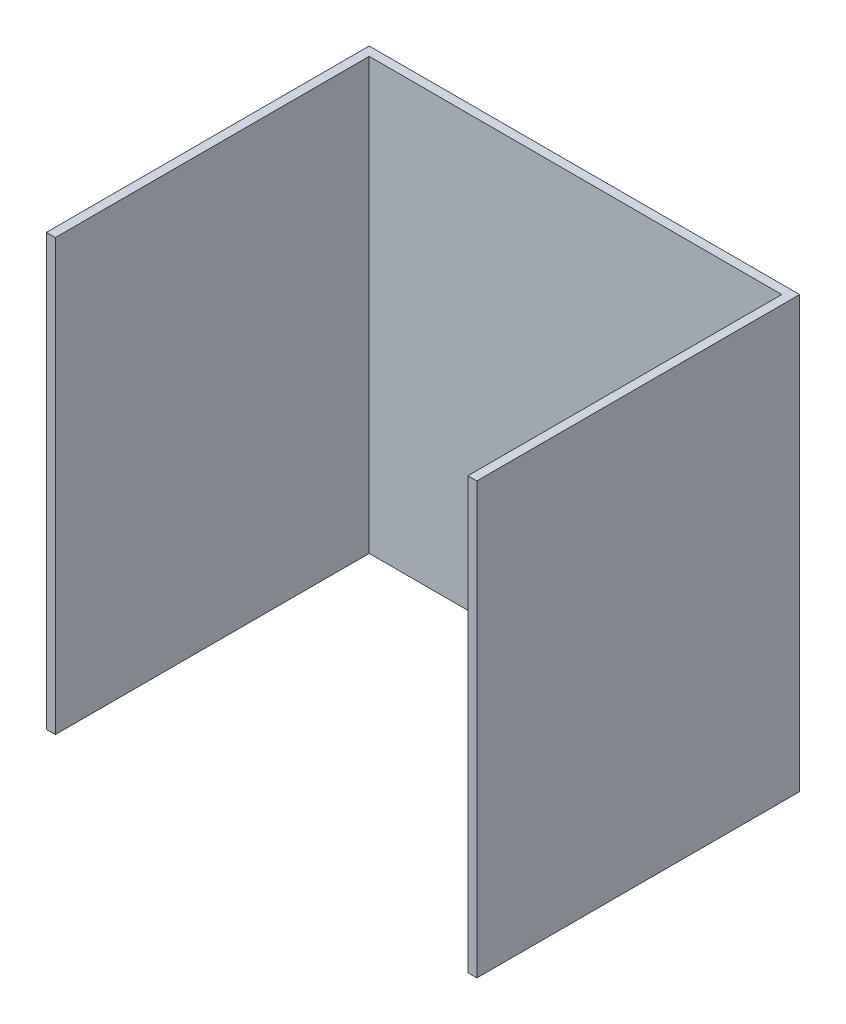
from build123d import *

# Parameters (mm, degrees)
SKETCH1_W           = 609.6
SKETCH1_H           = 457.2
BOSS_EXTRUDE1_DEPTH = 609.6
SHELL1_T            = -12.7


with BuildPart() as part:
    # Sketch1 → Boss-Extrude1 (new body)
    with BuildSketch(Plane(origin=(0, 0, 0), x_dir=(1, 0, 0), z_dir=(0, 1, 0))):
        with Locations((304.8, 228.6)):
            Rectangle(SKETCH1_W, SKETCH1_H)
    extrude(amount=BOSS_EXTRUDE1_DEPTH)

    # Shell1
    shell1_openings = [part.faces().sort_by_distance(p)[0] for p in [
        (304.8, 609.6, -228.6),
        (304.8, 0, -228.6),
        (304.8, 304.8, 0),
    ]]
    offset(amount=SHELL1_T, openings=shell1_openings, kind=Kind.INTERSECTION)


solid = part.part
